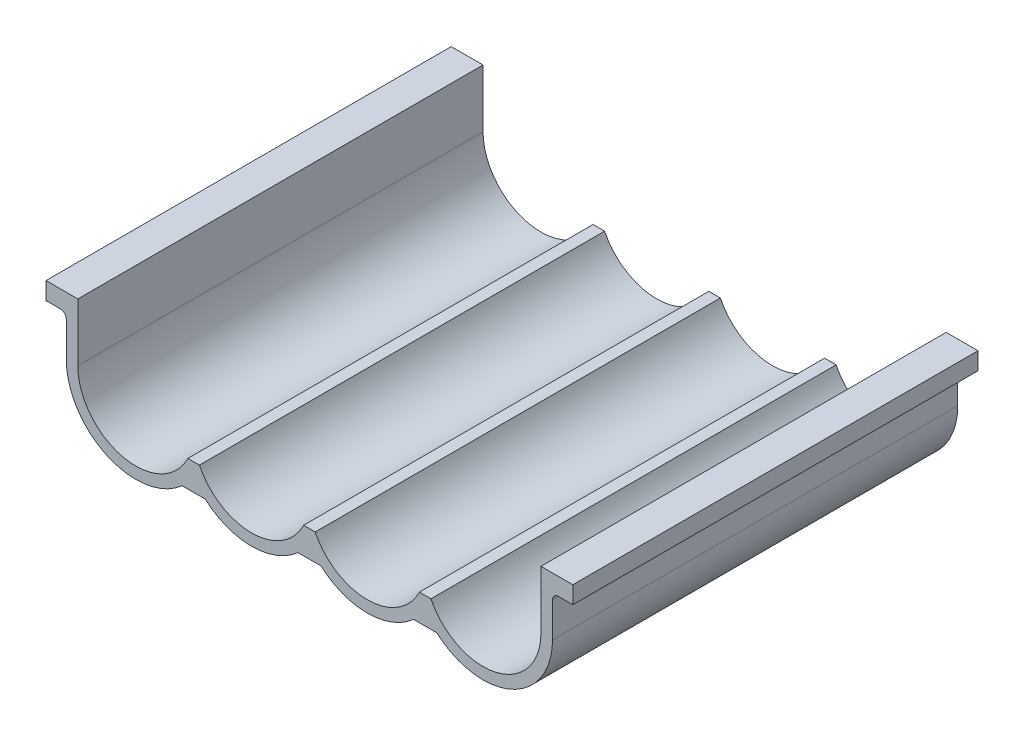
from build123d import *

# Parameters (mm, degrees)
BOSS_EXTRUDE1_DEPTH = 70
FILLET2_R           = 1


with BuildPart() as part:
    # Sketch1 → Boss-Extrude1 (new body)
    with BuildSketch(Plane.XY):
        with BuildLine():
            Line((0, 0), (5.5, 0))
            Line((5.5, 0), (5.5, -10))
            ThreePointArc((5.5, -10), (13.263932023, -19.746794345), (24.5, -14.358898944))
            Line((24.5, -14.358898944), (26.5, -14.358898944))
            ThreePointArc((26.5, -14.358898944), (35.5, -20), (44.5, -14.358898944))
            Line((44.5, -14.358898944), (46.5, -14.358898944))
            ThreePointArc((46.5, -14.358898944), (55.5, -20), (64.5, -14.358898944))
            Line((64.5, -14.358898944), (66.5, -14.358898944))
            ThreePointArc((66.5, -14.358898944), (77.736067977, -19.746794345), (85.5, -10))
            Line((85.5, -10), (85.5, 0))
            Line((85.5, 0), (91, 0))
            Line((91, 0), (91, -3))
            Line((91, -3), (87.5, -3))
            Line((87.5, -3), (87.5, -10))
            ThreePointArc((87.5, -10), (80.398979486, -20.95445115), (67.5, -18.94427191))
            Line((67.5, -18.94427191), (63.5, -18.94427191))
            ThreePointArc((63.5, -18.94427191), (55.5, -22), (47.5, -18.94427191))
            Line((47.5, -18.94427191), (43.5, -18.94427191))
            ThreePointArc((43.5, -18.94427191), (35.5, -22), (27.5, -18.94427191))
            Line((27.5, -18.94427191), (23.5, -18.94427191))
            ThreePointArc((23.5, -18.94427191), (10.601020514, -20.95445115), (3.5, -10))
            Line((3.5, -10), (3.5, -3))
            Line((3.5, -3), (0, -3))
            Line((0, -3), (0, 0))
        make_face()
    extrude(amount=BOSS_EXTRUDE1_DEPTH)

    # Fillet2
    fillet2_edges = [part.edges().sort_by_distance(p)[0] for p in [
        (87.5, -3, 35),
        (3.5, -3, 35),
    ]]
    fillet(fillet2_edges, radius=FILLET2_R)


solid = part.part
